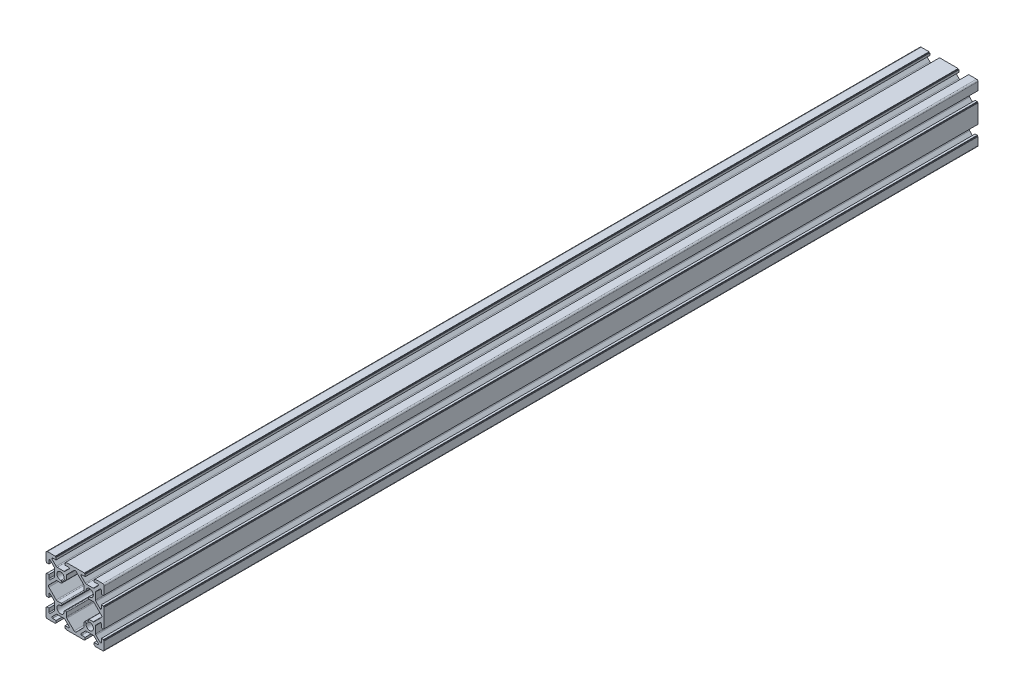
from build123d import *

# Parameters (mm, degrees)
EXTRUDE_1_DEPTH = 600


with BuildPart() as part:
    # 草图1 → 拉伸1 (new body)
    with BuildSketch(Plane.XY):
        with BuildLine():
            Line((29.173779204, 25.880575365), (26.320225813, 23.027021974))
            ThreePointArc((26.320225813, 23.027021974), (26.211839437, 22.482126867), (26.673779204, 22.173468583))
            Line((26.673779204, 22.173468583), (29.093880252, 22.173468583))
            Line((29.093880252, 22.173468583), (29.093880252, 20.673468583))
            Line((29.093880252, 20.673468583), (28.593880252, 20.673468583))
            Line((28.593880252, 20.673468583), (28.593880252, 20.173468583))
            Line((28.593880252, 20.173468583), (15.793880216, 20.173468583))
            Line((15.793880216, 20.173468583), (15.793880216, 20.673468583))
            Line((15.793880216, 20.673468583), (15.293880216, 20.673468583))
            Line((15.293880216, 20.673468583), (15.293880216, 22.173468583))
            Line((15.293880216, 22.173468583), (17.713981229, 22.173468583))
            ThreePointArc((17.713981229, 22.173468583), (18.175920995, 22.482126867), (18.06753462, 23.027021974))
            Line((18.06753462, 23.027021974), (15.213981229, 25.880575365))
            ThreePointArc((15.213981229, 25.880575365), (14.88955788, 26.097348116), (14.506874448, 26.173468583))
            Line((14.506874448, 26.173468583), (9.880885985, 26.173468583))
            ThreePointArc((9.880885985, 26.173468583), (9.498202552, 26.097348116), (9.173779204, 25.880575365))
            Line((9.173779204, 25.880575365), (6.320225813, 23.027021974))
            ThreePointArc((6.320225813, 23.027021974), (6.211839437, 22.482126867), (6.673779204, 22.173468583))
            Line((6.673779204, 22.173468583), (9.093880216, 22.173468583))
            Line((9.093880216, 22.173468583), (9.093880216, 20.673468583))
            Line((9.093880216, 20.673468583), (8.593880216, 20.673468583))
            Line((8.593880216, 20.673468583), (8.593880216, 20.173468583))
            Line((8.593880216, 20.173468583), (3.193880216, 20.173468583))
            ThreePointArc((3.193880216, 20.173468583), (2.486773435, 20.466361802), (2.193880216, 21.173468583))
            Line((2.193880216, 21.173468583), (2.193880216, 26.573468583))
            Line((2.193880216, 26.573468583), (2.693880216, 26.573468583))
            Line((2.693880216, 26.573468583), (2.693880216, 27.073468583))
            Line((2.693880216, 27.073468583), (4.193880216, 27.073468583))
            Line((4.193880216, 27.073468583), (4.193880216, 24.653367607))
            ThreePointArc((4.193880216, 24.653367607), (4.5025385, 24.191427841), (5.047433607, 24.299814216))
            Line((5.047433607, 24.299814216), (7.900986997, 27.153367607))
            ThreePointArc((7.900986997, 27.153367607), (8.117759749, 27.477790956), (8.193880216, 27.860474388))
            Line((8.193880216, 27.860474388), (8.193880216, 32.486462851))
            ThreePointArc((8.193880216, 32.486462851), (8.117759749, 32.869146283), (7.900986997, 33.193569632))
            Line((7.900986997, 33.193569632), (5.047433607, 36.047123023))
            ThreePointArc((5.047433607, 36.047123023), (4.5025385, 36.155509398), (4.193880216, 35.693569632))
            Line((4.193880216, 35.693569632), (4.193880216, 33.273468583))
            Line((4.193880216, 33.273468583), (2.693880216, 33.273468583))
            Line((2.693880216, 33.273468583), (2.693880216, 33.773468583))
            Line((2.693880216, 33.773468583), (2.193880216, 33.773468583))
            Line((2.193880216, 33.773468583), (2.193880216, 46.57346862))
            Line((2.193880216, 46.57346862), (2.693880216, 46.57346862))
            Line((2.693880216, 46.57346862), (2.693880216, 47.07346862))
            Line((2.693880216, 47.07346862), (4.193880216, 47.07346862))
            Line((4.193880216, 47.07346862), (4.193880216, 44.653367607))
            ThreePointArc((4.193880216, 44.653367607), (4.5025385, 44.191427841), (5.047433607, 44.299814216))
            Line((5.047433607, 44.299814216), (7.900986997, 47.153367607))
            ThreePointArc((7.900986997, 47.153367607), (8.117759749, 47.477790956), (8.193880216, 47.860474388))
            Line((8.193880216, 47.860474388), (8.193880216, 52.486462851))
            ThreePointArc((8.193880216, 52.486462851), (8.117759749, 52.869146283), (7.900986997, 53.193569632))
            Line((7.900986997, 53.193569632), (5.047433607, 56.047123023))
            ThreePointArc((5.047433607, 56.047123023), (4.5025385, 56.155509398), (4.193880216, 55.693569632))
            Line((4.193880216, 55.693569632), (4.193880216, 53.27346862))
            Line((4.193880216, 53.27346862), (2.693880216, 53.27346862))
            Line((2.693880216, 53.27346862), (2.693880216, 53.77346862))
            Line((2.693880216, 53.77346862), (2.193880216, 53.77346862))
            Line((2.193880216, 53.77346862), (2.193880216, 59.17346862))
            ThreePointArc((2.193880216, 59.17346862), (2.486773435, 59.880575401), (3.193880216, 60.17346862))
            Line((3.193880216, 60.17346862), (8.593880216, 60.17346862))
            Line((8.593880216, 60.17346862), (8.593880216, 59.67346862))
            Line((8.593880216, 59.67346862), (9.093880216, 59.67346862))
            Line((9.093880216, 59.67346862), (9.093880216, 58.17346862))
            Line((9.093880216, 58.17346862), (6.673779204, 58.17346862))
            ThreePointArc((6.673779204, 58.17346862), (6.211839437, 57.864810336), (6.320225813, 57.319915229))
            Line((6.320225813, 57.319915229), (9.173779204, 54.466361838))
            ThreePointArc((9.173779204, 54.466361838), (9.498202552, 54.249589087), (9.880885985, 54.17346862))
            Line((9.880885985, 54.17346862), (14.506874448, 54.17346862))
            ThreePointArc((14.506874448, 54.17346862), (14.88955788, 54.249589087), (15.213981229, 54.466361838))
            Line((15.213981229, 54.466361838), (18.06753462, 57.319915229))
            ThreePointArc((18.06753462, 57.319915229), (18.175920995, 57.864810336), (17.713981229, 58.17346862))
            Line((17.713981229, 58.17346862), (15.293880216, 58.17346862))
            Line((15.293880216, 58.17346862), (15.293880216, 59.67346862))
            Line((15.293880216, 59.67346862), (15.793880216, 59.67346862))
            Line((15.793880216, 59.67346862), (15.793880216, 60.17346862))
            Line((15.793880216, 60.17346862), (28.593880252, 60.17346862))
            Line((28.593880252, 60.17346862), (28.593880252, 59.67346862))
            Line((28.593880252, 59.67346862), (29.093880252, 59.67346862))
            Line((29.093880252, 59.67346862), (29.093880252, 58.17346862))
            Line((29.093880252, 58.17346862), (26.673779204, 58.17346862))
            ThreePointArc((26.673779204, 58.17346862), (26.211839437, 57.864810336), (26.320225813, 57.319915229))
            Line((26.320225813, 57.319915229), (29.173779204, 54.466361838))
            ThreePointArc((29.173779204, 54.466361838), (29.498202552, 54.249589087), (29.880885985, 54.17346862))
            Line((29.880885985, 54.17346862), (34.506874448, 54.17346862))
            ThreePointArc((34.506874448, 54.17346862), (34.88955788, 54.249589087), (35.213981229, 54.466361838))
            Line((35.213981229, 54.466361838), (38.06753462, 57.319915229))
            ThreePointArc((38.06753462, 57.319915229), (38.175920995, 57.864810336), (37.713981229, 58.17346862))
            Line((37.713981229, 58.17346862), (35.293880216, 58.17346862))
            Line((35.293880216, 58.17346862), (35.293880216, 59.67346862))
            Line((35.293880216, 59.67346862), (35.793880216, 59.67346862))
            Line((35.793880216, 59.67346862), (35.793880216, 60.17346862))
            Line((35.793880216, 60.17346862), (41.193880216, 60.17346862))
            ThreePointArc((41.193880216, 60.17346862), (41.900986997, 59.880575401), (42.193880216, 59.17346862))
            Line((42.193880216, 59.17346862), (42.193880216, 53.77346862))
            Line((42.193880216, 53.77346862), (41.693880216, 53.77346862))
            Line((41.693880216, 53.77346862), (41.693880216, 53.27346862))
            Line((41.693880216, 53.27346862), (40.193880216, 53.27346862))
            Line((40.193880216, 53.27346862), (40.193880216, 55.693569632))
            ThreePointArc((40.193880216, 55.693569632), (39.885221932, 56.155509398), (39.340326826, 56.047123023))
            Line((39.340326826, 56.047123023), (36.486773435, 53.193569632))
            ThreePointArc((36.486773435, 53.193569632), (36.270000684, 52.869146283), (36.193880216, 52.486462851))
            Line((36.193880216, 52.486462851), (36.193880216, 47.860474388))
            ThreePointArc((36.193880216, 47.860474388), (36.270000684, 47.477790956), (36.486773435, 47.153367607))
            Line((36.486773435, 47.153367607), (39.340326826, 44.299814216))
            ThreePointArc((39.340326826, 44.299814216), (39.885221932, 44.191427841), (40.193880216, 44.653367607))
            Line((40.193880216, 44.653367607), (40.193880216, 47.07346862))
            Line((40.193880216, 47.07346862), (41.693880216, 47.07346862))
            Line((41.693880216, 47.07346862), (41.693880216, 46.57346862))
            Line((41.693880216, 46.57346862), (42.193880216, 46.57346862))
            Line((42.193880216, 46.57346862), (42.193880216, 33.773468583))
            Line((42.193880216, 33.773468583), (41.693880216, 33.773468583))
            Line((41.693880216, 33.773468583), (41.693880216, 33.273468583))
            Line((41.693880216, 33.273468583), (40.193880216, 33.273468583))
            Line((40.193880216, 33.273468583), (40.193880216, 35.693569632))
            ThreePointArc((40.193880216, 35.693569632), (39.885221932, 36.155509398), (39.340326826, 36.047123023))
            Line((39.340326826, 36.047123023), (36.486773435, 33.193569632))
            ThreePointArc((36.486773435, 33.193569632), (36.270000684, 32.869146283), (36.193880216, 32.486462851))
            Line((36.193880216, 32.486462851), (36.193880216, 27.860474388))
            ThreePointArc((36.193880216, 27.860474388), (36.270000684, 27.477790956), (36.486773435, 27.153367607))
            Line((36.486773435, 27.153367607), (39.340326826, 24.299814216))
            ThreePointArc((39.340326826, 24.299814216), (39.885221932, 24.191427841), (40.193880216, 24.653367607))
            Line((40.193880216, 24.653367607), (40.193880216, 27.073468583))
            Line((40.193880216, 27.073468583), (41.693880216, 27.073468583))
            Line((41.693880216, 27.073468583), (41.693880216, 26.573468583))
            Line((41.693880216, 26.573468583), (42.193880216, 26.573468583))
            Line((42.193880216, 26.573468583), (42.193880216, 21.173468583))
            ThreePointArc((42.193880216, 21.173468583), (41.900986997, 20.466361802), (41.193880216, 20.173468583))
            Line((41.193880216, 20.173468583), (35.793880216, 20.173468583))
            Line((35.793880216, 20.173468583), (35.793880216, 20.673468583))
            Line((35.793880216, 20.673468583), (35.293880216, 20.673468583))
            Line((35.293880216, 20.673468583), (35.293880216, 22.173468583))
            Line((35.293880216, 22.173468583), (37.713981229, 22.173468583))
            ThreePointArc((37.713981229, 22.173468583), (38.175920995, 22.482126867), (38.06753462, 23.027021974))
            Line((38.06753462, 23.027021974), (35.213981229, 25.880575365))
            ThreePointArc((35.213981229, 25.880575365), (34.88955788, 26.097348116), (34.506874448, 26.173468583))
            Line((34.506874448, 26.173468583), (29.880885985, 26.173468583))
            ThreePointArc((29.880885985, 26.173468583), (29.498202552, 26.097348116), (29.173779204, 25.880575365))
        make_face()
        with BuildLine():
            Line((31.428283161, 33.030715769), (31.290733225, 33.54405912))
            ThreePointArc((31.290733225, 33.54405912), (31.377019468, 33.977849357), (31.773696138, 34.173468643))
            Line((31.773696138, 34.173468643), (34.506874453, 34.173468643))
            ThreePointArc((34.506874453, 34.173468643), (34.889557885, 34.24958911), (35.213981234, 34.466361862))
            Line((35.213981234, 34.466361862), (40.213981229, 39.466361856))
            ThreePointArc((40.213981229, 39.466361856), (40.506874448, 40.173468638), (40.213981229, 40.880575419))
            Line((40.213981229, 40.880575419), (35.213981224, 45.880575424))
            ThreePointArc((35.213981224, 45.880575424), (34.889557875, 46.097348175), (34.506874443, 46.173468643))
            Line((34.506874443, 46.173468643), (31.773696128, 46.173468643))
            ThreePointArc((31.773696128, 46.173468643), (31.377019458, 46.369087928), (31.290733215, 46.802878165))
            Line((31.290733215, 46.802878165), (31.428283151, 47.316221516))
            ThreePointArc((31.428283151, 47.316221516), (31.625910534, 47.597401369), (31.958351755, 47.684588102))
            ThreePointArc((31.958351755, 47.684588102), (33.961647164, 51.941235596), (29.70499967, 49.937940187))
            ThreePointArc((29.70499967, 49.937940187), (29.617812937, 49.605498966), (29.336633085, 49.407871583))
            Line((29.336633085, 49.407871583), (28.823289734, 49.270321646))
            ThreePointArc((28.823289734, 49.270321646), (28.389499497, 49.356607889), (28.193880211, 49.75328456))
            Line((28.193880211, 49.75328456), (28.193880211, 52.486462874))
            ThreePointArc((28.193880211, 52.486462874), (28.117759744, 52.869146307), (27.900986992, 53.193569656))
            Line((27.900986992, 53.193569656), (22.900987001, 58.193569646))
            ThreePointArc((22.900987001, 58.193569646), (22.19388022, 58.486462865), (21.486773439, 58.193569646))
            Line((21.486773439, 58.193569646), (16.48677343, 53.193569637))
            ThreePointArc((16.48677343, 53.193569637), (16.270000679, 52.869146289), (16.193880211, 52.486462856))
            Line((16.193880211, 52.486462856), (16.193880211, 49.753284541))
            ThreePointArc((16.193880211, 49.753284541), (15.998260926, 49.356607871), (15.564470689, 49.270321628))
            Line((15.564470689, 49.270321628), (15.051127338, 49.407871565))
            ThreePointArc((15.051127338, 49.407871565), (14.769947485, 49.605498947), (14.682760752, 49.937940169))
            ThreePointArc((14.682760752, 49.937940169), (10.426113258, 51.941235578), (12.429408667, 47.684588084))
            ThreePointArc((12.429408667, 47.684588084), (12.761849888, 47.597401351), (12.959477271, 47.316221498))
            Line((12.959477271, 47.316221498), (13.097027208, 46.802878147))
            ThreePointArc((13.097027208, 46.802878147), (13.010740965, 46.36908791), (12.614064294, 46.173468625))
            Line((12.614064294, 46.173468625), (9.88088598, 46.173468625))
            ThreePointArc((9.88088598, 46.173468625), (9.498202547, 46.097348157), (9.173779198, 45.880575406))
            Line((9.173779198, 45.880575406), (4.173779204, 40.880575411))
            ThreePointArc((4.173779204, 40.880575411), (3.880885985, 40.17346863), (4.173779204, 39.466361849))
            Line((4.173779204, 39.466361849), (9.173779209, 34.466361844))
            ThreePointArc((9.173779209, 34.466361844), (9.498202558, 34.249589092), (9.88088599, 34.173468625))
            Line((9.88088599, 34.173468625), (12.614064305, 34.173468625))
            ThreePointArc((12.614064305, 34.173468625), (13.010740975, 33.977849339), (13.097027218, 33.544059102))
            Line((13.097027218, 33.544059102), (12.959477282, 33.030715751))
            ThreePointArc((12.959477282, 33.030715751), (12.761849899, 32.749535898), (12.429408677, 32.662349166))
            ThreePointArc((12.429408677, 32.662349166), (10.426113269, 28.405701672), (14.682760762, 30.408997081))
            ThreePointArc((14.682760762, 30.408997081), (14.769947495, 30.741438302), (15.051127348, 30.939065685))
            Line((15.051127348, 30.939065685), (15.564470699, 31.076615621))
            ThreePointArc((15.564470699, 31.076615621), (15.998260936, 30.990329378), (16.193880222, 30.593652708))
            Line((16.193880222, 30.593652708), (16.193880222, 27.860474393))
            ThreePointArc((16.193880222, 27.860474393), (16.270000689, 27.477790961), (16.48677344, 27.153367612))
            Line((16.48677344, 27.153367612), (21.486773431, 22.153367621))
            ThreePointArc((21.486773431, 22.153367621), (22.193880212, 21.860474402), (22.900986994, 22.153367621))
            Line((22.900986994, 22.153367621), (27.900987003, 27.15336763))
            ThreePointArc((27.900987003, 27.15336763), (28.117759754, 27.477790979), (28.193880222, 27.860474411))
            Line((28.193880222, 27.860474411), (28.193880222, 30.593652726))
            ThreePointArc((28.193880222, 30.593652726), (28.389499507, 30.990329396), (28.823289744, 31.076615639))
            Line((28.823289744, 31.076615639), (29.336633095, 30.939065703))
            ThreePointArc((29.336633095, 30.939065703), (29.617812948, 30.74143832), (29.704999681, 30.408997099))
            ThreePointArc((29.704999681, 30.408997099), (33.961647174, 28.40570169), (31.958351766, 32.662349184))
            ThreePointArc((31.958351766, 32.662349184), (31.625910544, 32.749535916), (31.428283161, 33.030715769))
        make_face(mode=Mode.SUBTRACT)
    extrude(amount=EXTRUDE_1_DEPTH)


solid = part.part
